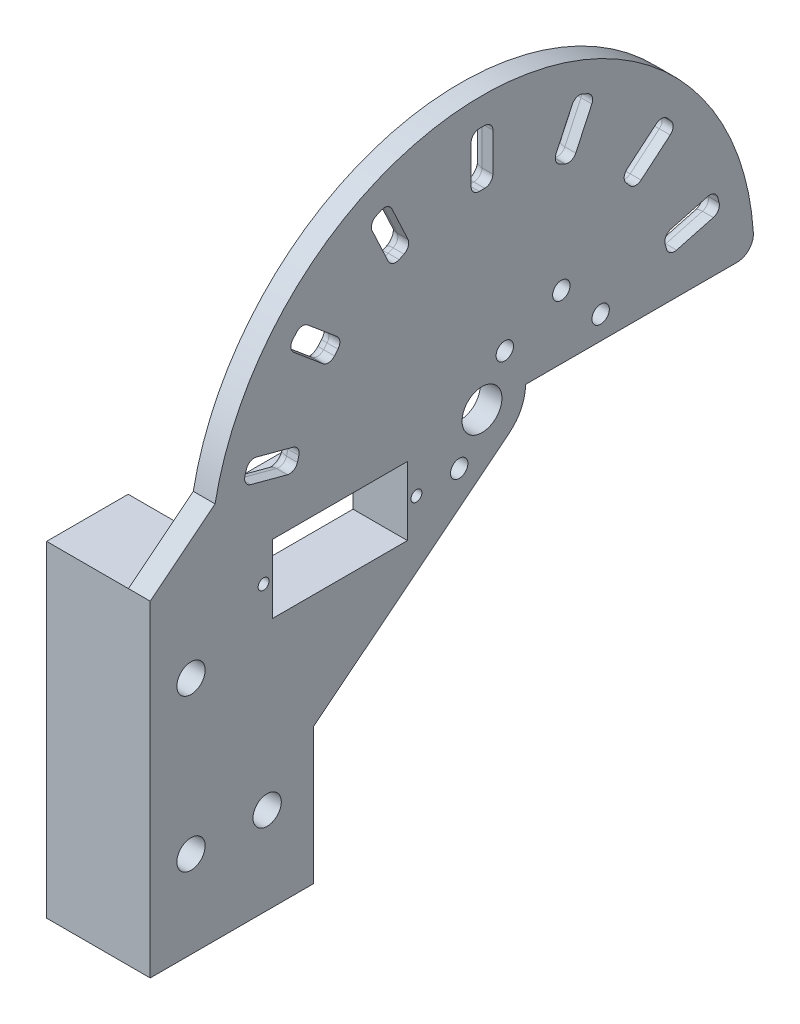
from build123d import *

# Parameters (mm, degrees)
BOSS_EXTRUDE1_START          = -21.95
BOSS_EXTRUDE1_DEPTH          = 10
BOSS_EXTRUDE2_START          = -11.95
SKETCH1_3_R                  = 1.6
SKETCH1_3_R_2                = 3.6655
BOSS_EXTRUDE2_DEPTH          = 4
BOSS_EXTRUDE3_START          = -11.95
SKETCH1_5_R                  = 1.6
SKETCH1_5_R_2                = 3.6655
BOSS_EXTRUDE3_DEPTH          = 4
BOSS_EXTRUDE4_DEPTH          = 15.05
SKETCH3_R                    = 2.6
CUT_EXTRUDE1_DEPTH           = 3.9
CUT_EXTRUDE1_DRAFT           = -1.5
CUT_EXTRUDE1_PROFILE_2_DEPTH = 3.9
CUT_EXTRUDE1_PROFILE_2_DRAFT = -1.5
SKETCH3_3_R                  = 1.6
CUT_EXTRUDE2_DEPTH           = 10
SKETCH4_R                    = 1.6
CUT_EXTRUDE3_DEPTH           = 94.316142762
SKETCH4_3_R                  = 2.6
CUT_EXTRUDE4_DEPTH           = 3.9
CUT_EXTRUDE4_DRAFT           = -1.5
CUT_EXTRUDE4_PROFILE_2_DEPTH = 3.9
CUT_EXTRUDE4_PROFILE_2_DRAFT = -1.5
CUT_EXTRUDE4_PROFILE_3_DEPTH = 3.9
CUT_EXTRUDE4_PROFILE_3_DRAFT = -1.5
BOSS_EXTRUDE5_DEPTH          = 4
SKETCH6_R                    = 1.6
CUT_EXTRUDE5_DEPTH           = 99.607821698
SKETCH7_R                    = 1.6
CUT_EXTRUDE6_DEPTH           = 99.607821698
SKETCH8_R                    = 1
CUT_EXTRUDE7_DEPTH           = 98.964279204
BOSS_EXTRUDE6_DEPTH          = 4
CUT_EXTRUDE8_DEPTH           = 127.678737363
FILLET1_R                    = 2


with BuildPart() as part:
    # Sketch1 → Boss-Extrude1 (new body)
    with BuildSketch(Plane(origin=(0, 0, 0), x_dir=(0, 0, -1), z_dir=(1, 0, 0)).offset(BOSS_EXTRUDE1_START)):
        Polygon((-8.460952046, 43.003061543), (-7.709637027, 43.603174314), (-7.709637027, 61.603061543), (-44.509637027, 61.603061543), (-44.509637027, 43.003061543), align=None)
        Polygon((-38.509637027, 46.003061543), (-38.509637027, 58.603061543), (-36.609637027, 58.603061543), (-15.609637027, 58.603061543), (-13.709637027, 58.603061543), (-13.709637027, 55.244664886), (-13.709637027, 46.003061543), (-15.609637027, 46.003061543), (-36.609637027, 46.003061543), align=None, mode=Mode.SUBTRACT)
    extrude(amount=BOSS_EXTRUDE1_DEPTH)

    # Sketch1<3> → Boss-Extrude2 (add)
    with BuildSketch(Plane(origin=(0, 0, 0), x_dir=(0, 0, -1), z_dir=(1, 0, 0)).offset(BOSS_EXTRUDE2_START)):
        with BuildLine():
            Line((-7.709637027, 61.603061543), (-7.709637027, 43.603174314))
            Line((-7.709637027, 43.603174314), (4.992794118, 53.749239495))
            ThreePointArc((4.992794118, 53.749239495), (7.359885637, 63.135615316), (-1.049180328, 67.930902889))
            Line((-1.049180328, 67.930902889), (-61, 60))
            Line((-61, 60), (-61, 0))
            Line((-61, 0), (-31, 0))
            Line((-31, 0), (-31, 25))
            Line((-31, 25), (-8.460952046, 43.003061543))
            Line((-8.460952046, 43.003061543), (-44.509637027, 43.003061543))
            Line((-44.509637027, 43.003061543), (-44.509637027, 61.603061543))
            Line((-44.509637027, 61.603061543), (-7.709637027, 61.603061543))
        make_face()
        with Locations(Location((-4.191, 52.740975065, 0), (0, 0, 90))):
            Circle(SKETCH1_3_R, mode=Mode.SUBTRACT)
        with Locations(Location((0, 60, 0), (0, 0, 90))):
            Circle(SKETCH1_3_R_2, mode=Mode.SUBTRACT)
    extrude(amount=-BOSS_EXTRUDE2_DEPTH)

    # Sketch1<5> → Boss-Extrude3 (add)
    with BuildSketch(Plane(origin=(0, 0, 0), x_dir=(0, 0, -1), z_dir=(1, 0, 0)).offset(BOSS_EXTRUDE3_START)):
        with BuildLine():
            Line((-7.709637027, 61.603061543), (-7.709637027, 43.603174314))
            Line((-7.709637027, 43.603174314), (4.992794118, 53.749239495))
            ThreePointArc((4.992794118, 53.749239495), (7.359885637, 63.135615316), (-1.049180328, 67.930902889))
            Line((-1.049180328, 67.930902889), (-61, 60))
            Line((-61, 60), (-61, 0))
            Line((-61, 0), (-31, 0))
            Line((-31, 0), (-31, 25))
            Line((-31, 25), (-8.460952046, 43.003061543))
            Line((-8.460952046, 43.003061543), (-44.509637027, 43.003061543))
            Line((-44.509637027, 43.003061543), (-44.509637027, 61.603061543))
            Line((-44.509637027, 61.603061543), (-7.709637027, 61.603061543))
        make_face()
        with Locations(Location((-4.191, 52.740975065, 0), (0, 0, 90))):
            Circle(SKETCH1_5_R, mode=Mode.SUBTRACT)
        with Locations(Location((0, 60, 0), (0, 0, 90))):
            Circle(SKETCH1_5_R_2, mode=Mode.SUBTRACT)
    extrude(amount=-BOSS_EXTRUDE3_DEPTH)

    # Sketch2 → Boss-Extrude4 (add)
    with BuildSketch(Plane.ZY.offset(15.95)):
        Polygon((31, 25), (31, 30), (46, 30), (46, 60), (61, 60), (61, 0), (31, 0), align=None)
    extrude(amount=BOSS_EXTRUDE4_DEPTH)


with BuildPart() as cut_extrude1_tool:
    # Sketch3 → Cut-Extrude1 (with draft: the straight prism first)
    with BuildSketch(Plane.XZ):
        with Locations((-21.475, 53.5)):
            Circle(SKETCH3_R)
    extrude(amount=-CUT_EXTRUDE1_DEPTH)
    # Cut-Extrude1: the draft: its side faces are tilted about the plane it starts from
    cut_extrude1_sides = [cut_extrude1_tool.faces().sort_by_distance(p)[0] for p in [
        (-24.075, 1.95, 53.5),
    ]]
    draft(cut_extrude1_sides, Plane.XZ, CUT_EXTRUDE1_DRAFT)


with BuildPart() as part_1:
    add(part.part)

    # Cut-Extrude1: cut by cut_extrude1_tool
    add(cut_extrude1_tool.part, mode=Mode.SUBTRACT)


with BuildPart() as cut_extrude1_profile_2_tool:
    # Sketch3 → Cut-Extrude1 profile 2 (with draft: the straight prism first)
    with BuildSketch(Plane.XZ):
        with Locations((-21.475, 38.5)):
            Circle(SKETCH3_R)
    extrude(amount=-CUT_EXTRUDE1_PROFILE_2_DEPTH)
    # Cut-Extrude1 profile 2: the draft: its side faces are tilted about the plane it starts from
    cut_extrude1_profile_2_sides = [cut_extrude1_profile_2_tool.faces().sort_by_distance(p)[0] for p in [
        (-24.075, 1.95, 38.5),
    ]]
    draft(cut_extrude1_profile_2_sides, Plane.XZ, CUT_EXTRUDE1_PROFILE_2_DRAFT)


with BuildPart() as part_2:
    add(part_1.part)

    # Cut-Extrude1 profile 2: cut by cut_extrude1_profile_2_tool
    add(cut_extrude1_profile_2_tool.part, mode=Mode.SUBTRACT)

    # Sketch3<3> → Cut-Extrude2 (cut)
    with BuildSketch(Plane.XZ):
        with Locations(Location((-21.475, 53.5, 0), (0, 0, 270))):
            Circle(SKETCH3_3_R)
        with Locations(Location((-21.475, 38.5, 0), (0, 0, 270))):
            Circle(SKETCH3_3_R)
    extrude(amount=-CUT_EXTRUDE2_DEPTH, mode=Mode.SUBTRACT)

    # Sketch4 → Cut-Extrude3 (cut, through all)
    with BuildSketch(Plane(origin=(-11.95, 0, 0), x_dir=(0, 0, -1), z_dir=(1, 0, 0))):
        with Locations(Location((-53.5, 44, 0), (0, 0, 90))):
            Circle(SKETCH4_R)
        with Locations(Location((-53.5, 16, 0), (0, 0, 90))):
            Circle(SKETCH4_R)
        with Locations(Location((-39.5, 16, 0), (0, 0, 90))):
            Circle(SKETCH4_R)
    extrude(amount=-CUT_EXTRUDE3_DEPTH, mode=Mode.SUBTRACT)


with BuildPart() as cut_extrude4_tool:
    # Sketch4<3> → Cut-Extrude4 (with draft: the straight prism first)
    with BuildSketch(Plane(origin=(-11.95, 0, 0), x_dir=(0, 0, -1), z_dir=(1, 0, 0))):
        with Locations((-39.5, 16)):
            Circle(SKETCH4_3_R)
    extrude(amount=-CUT_EXTRUDE4_DEPTH)
    # Cut-Extrude4: the draft: its side faces are tilted about the plane it starts from
    cut_extrude4_sides = [cut_extrude4_tool.faces().sort_by_distance(p)[0] for p in [
        (-13.9, 16, 42.1),
    ]]
    draft(cut_extrude4_sides, Plane(origin=(-11.95, 0, 0), x_dir=(0, 0, -1), z_dir=(1, 0, 0)), CUT_EXTRUDE4_DRAFT)


with BuildPart() as part_3:
    add(part_2.part)

    # Cut-Extrude4: cut by cut_extrude4_tool
    add(cut_extrude4_tool.part, mode=Mode.SUBTRACT)


with BuildPart() as cut_extrude4_profile_2_tool:
    # Sketch4<3> → Cut-Extrude4 profile 2 (with draft: the straight prism first)
    with BuildSketch(Plane(origin=(-11.95, 0, 0), x_dir=(0, 0, -1), z_dir=(1, 0, 0))):
        with Locations((-53.5, 44)):
            Circle(SKETCH4_3_R)
    extrude(amount=-CUT_EXTRUDE4_PROFILE_2_DEPTH)
    # Cut-Extrude4 profile 2: the draft: its side faces are tilted about the plane it starts from
    cut_extrude4_profile_2_sides = [cut_extrude4_profile_2_tool.faces().sort_by_distance(p)[0] for p in [
        (-13.9, 44, 56.1),
    ]]
    draft(cut_extrude4_profile_2_sides, Plane(origin=(-11.95, 0, 0), x_dir=(0, 0, -1), z_dir=(1, 0, 0)), CUT_EXTRUDE4_PROFILE_2_DRAFT)


with BuildPart() as part_4:
    add(part_3.part)

    # Cut-Extrude4 profile 2: cut by cut_extrude4_profile_2_tool
    add(cut_extrude4_profile_2_tool.part, mode=Mode.SUBTRACT)


with BuildPart() as cut_extrude4_profile_3_tool:
    # Sketch4<3> → Cut-Extrude4 profile 3 (with draft: the straight prism first)
    with BuildSketch(Plane(origin=(-11.95, 0, 0), x_dir=(0, 0, -1), z_dir=(1, 0, 0))):
        with Locations((-53.5, 16)):
            Circle(SKETCH4_3_R)
    extrude(amount=-CUT_EXTRUDE4_PROFILE_3_DEPTH)
    # Cut-Extrude4 profile 3: the draft: its side faces are tilted about the plane it starts from
    cut_extrude4_profile_3_sides = [cut_extrude4_profile_3_tool.faces().sort_by_distance(p)[0] for p in [
        (-13.9, 16, 56.1),
    ]]
    draft(cut_extrude4_profile_3_sides, Plane(origin=(-11.95, 0, 0), x_dir=(0, 0, -1), z_dir=(1, 0, 0)), CUT_EXTRUDE4_PROFILE_3_DRAFT)


with BuildPart() as part_5:
    add(part_4.part)

    # Cut-Extrude4 profile 3: cut by cut_extrude4_profile_3_tool
    add(cut_extrude4_profile_3_tool.part, mode=Mode.SUBTRACT)

    # Sketch5 → Boss-Extrude5 (add)
    with BuildSketch(Plane(origin=(-11.95, 0, 0), x_dir=(0, 0, -1), z_dir=(1, 0, 0))):
        with BuildLine():
            Line((-41, 76), (-61, 60))
            Line((-61, 60), (-1.049180328, 67.930902889))
            ThreePointArc((-1.049180328, 67.930902889), (5.272881441, 66.016371108), (8, 60))
            Line((8, 60), (26, 60))
            Line((26, 60), (26, 76))
            Line((26, 76), (-41, 76))
        make_face()
    extrude(amount=-BOSS_EXTRUDE5_DEPTH)

    # Sketch6 → Cut-Extrude5 (cut, through all)
    with BuildSketch(Plane.ZY.offset(15.95)):
        with Locations(Location((-14.588600817, 71.703999162, 0), (0, 0, 270))):
            Circle(SKETCH6_R)
        with Locations(Location((-21.811399183, 64.296000838, 0), (0, 0, 270))):
            Circle(SKETCH6_R)
    extrude(amount=-CUT_EXTRUDE5_DEPTH, mode=Mode.SUBTRACT)

    # Sketch7 → Cut-Extrude6 (cut, through all)
    with BuildSketch(Plane.ZY.offset(15.95)):
        with Locations(Location((-4.191, 67.259024935, 0), (0, 0, 90))):
            Circle(SKETCH7_R)
    extrude(amount=-CUT_EXTRUDE6_DEPTH, mode=Mode.SUBTRACT)

    # Sketch8 → Cut-Extrude7 (cut, through all)
    with BuildSketch(Plane.ZY.offset(21.95)):
        with Locations(Location((12.059637027, 52.303061543, 0), (0, 0, 270))):
            Circle(SKETCH8_R)
        with Locations(Location((40.159637027, 52.303061543, 0), (0, 0, 270))):
            Circle(SKETCH8_R)
    extrude(amount=-CUT_EXTRUDE7_DEPTH, mode=Mode.SUBTRACT)

    # Sketch10 → Boss-Extrude6 (add)
    with BuildSketch(Plane.ZY.offset(15.95)):
        with BuildLine():
            Line((-26, 60), (-26, 76))
            Line((-26, 76), (41, 76))
            Line((41, 76), (49.082633128, 69.533893498))
            ThreePointArc((49.082633128, 69.533893498), (-3.197302714, 109.897667835), (-49.898039998, 63.191489362))
            ThreePointArc((-49.898039998, 63.191489362), (-49.092132471, 60.947497635), (-46.904157598, 60))
            Line((-46.904157598, 60), (-26, 60))
        make_face()
    extrude(amount=-BOSS_EXTRUDE6_DEPTH)

    # Detent Cutouts → Cut-Extrude8 (cut, through all)
    with BuildSketch(Plane.ZY.offset(15.95)):
        with BuildLine():
            Line((35.770480839, 67.514119093), (42.531961623, 69.325852408))
            ThreePointArc((42.531961623, 69.325852408), (43.442771161, 70.024741148), (43.592621794, 71.162969716))
            Line((43.592621794, 71.162969716), (43.333802749, 72.128895542))
            ThreePointArc((43.333802749, 72.128895542), (42.63491401, 73.03970508), (41.496685442, 73.189555714))
            Line((41.496685442, 73.189555714), (34.735204658, 71.377822398))
            ThreePointArc((34.735204658, 71.377822398), (33.82439512, 70.678933658), (33.674544486, 69.540705091))
            Line((33.674544486, 69.540705091), (33.933363532, 68.574779265))
            ThreePointArc((33.933363532, 68.574779265), (34.632252271, 67.663969727), (35.770480839, 67.514119093))
        make_face()
        with BuildLine():
            Line((26.672310942, 84.991540853), (32.034622044, 89.49105412))
            ThreePointArc((32.034622044, 89.49105412), (33.129537072, 89.836279503), (34.147870123, 89.30616887))
            Line((34.147870123, 89.30616887), (34.790657733, 88.540124427))
            ThreePointArc((34.790657733, 88.540124427), (35.135883115, 87.445209399), (34.605772482, 86.426876348))
            Line((34.605772482, 86.426876348), (29.243461381, 81.92736308))
            ThreePointArc((29.243461381, 81.92736308), (28.148546352, 81.582137698), (27.130213301, 82.11224833))
            Line((27.130213301, 82.11224833), (26.487425692, 82.878292773))
            ThreePointArc((26.487425692, 82.878292773), (26.142200309, 83.973207802), (26.672310942, 84.991540853))
        make_face()
        with BuildLine():
            Line((13.611441552, 93.922233772), (16.569769384, 100.266388281))
            ThreePointArc((16.569769384, 100.266388281), (17.416200849, 101.041999819), (18.563158457, 100.991922569))
            Line((18.563158457, 100.991922569), (19.469466244, 100.569304307))
            ThreePointArc((19.469466244, 100.569304307), (20.245077782, 99.722872842), (20.195000532, 98.575915234))
            Line((20.195000532, 98.575915234), (17.2366727, 92.231760725))
            ThreePointArc((17.2366727, 92.231760725), (16.390241234, 91.456149186), (15.243283626, 91.506226437))
            Line((15.243283626, 91.506226437), (14.336975839, 91.928844698))
            ThreePointArc((14.336975839, 91.928844698), (13.561364301, 92.775276164), (13.611441552, 93.922233772))
        make_face()
        with BuildLine():
            Line((-2, 96.496428389), (-2, 103.496428389))
            ThreePointArc((-2, 103.496428389), (-1.560660172, 104.557088561), (-0.5, 104.996428389))
            Line((-0.5, 104.996428389), (0.5, 104.996428389))
            ThreePointArc((0.5, 104.996428389), (1.560660172, 104.557088561), (2, 103.496428389))
            Line((2, 103.496428389), (2, 96.496428389))
            ThreePointArc((2, 96.496428389), (1.560660172, 95.435768217), (0.5, 94.996428389))
            Line((0.5, 94.996428389), (-0.5, 94.996428389))
            ThreePointArc((-0.5, 94.996428389), (-1.560660172, 95.435768217), (-2, 96.496428389))
        make_face()
        with BuildLine():
            Line((-17.2366727, 92.231760725), (-20.195000532, 98.575915234))
            ThreePointArc((-20.195000532, 98.575915234), (-20.245077782, 99.722872842), (-19.469466244, 100.569304307))
            Line((-19.469466244, 100.569304307), (-18.563158457, 100.991922569))
            ThreePointArc((-18.563158457, 100.991922569), (-17.416200849, 101.041999819), (-16.569769384, 100.266388281))
            Line((-16.569769384, 100.266388281), (-13.611441552, 93.922233772))
            ThreePointArc((-13.611441552, 93.922233772), (-13.561364301, 92.775276164), (-14.336975839, 91.928844698))
            Line((-14.336975839, 91.928844698), (-15.243283626, 91.506226437))
            ThreePointArc((-15.243283626, 91.506226437), (-16.390241234, 91.456149186), (-17.2366727, 92.231760725))
        make_face()
        with BuildLine():
            Line((-29.243461381, 81.92736308), (-34.605772482, 86.426876348))
            ThreePointArc((-34.605772482, 86.426876348), (-35.135883115, 87.445209399), (-34.790657733, 88.540124427))
            Line((-34.790657733, 88.540124427), (-34.147870123, 89.30616887))
            ThreePointArc((-34.147870123, 89.30616887), (-33.129537072, 89.836279503), (-32.034622044, 89.49105412))
            Line((-32.034622044, 89.49105412), (-26.672310942, 84.991540853))
            ThreePointArc((-26.672310942, 84.991540853), (-26.142200309, 83.973207802), (-26.487425692, 82.878292773))
            Line((-26.487425692, 82.878292773), (-27.130213301, 82.11224833))
            ThreePointArc((-27.130213301, 82.11224833), (-28.148546352, 81.582137698), (-29.243461381, 81.92736308))
        make_face()
        with BuildLine():
            Line((-35.770480839, 67.514119093), (-42.531961623, 69.325852408))
            ThreePointArc((-42.531961623, 69.325852408), (-43.442771161, 70.024741148), (-43.592621794, 71.162969716))
            Line((-43.592621794, 71.162969716), (-43.333802749, 72.128895542))
            ThreePointArc((-43.333802749, 72.128895542), (-42.63491401, 73.03970508), (-41.496685442, 73.189555714))
            Line((-41.496685442, 73.189555714), (-34.735204658, 71.377822398))
            ThreePointArc((-34.735204658, 71.377822398), (-33.82439512, 70.678933658), (-33.674544486, 69.540705091))
            Line((-33.674544486, 69.540705091), (-33.933363532, 68.574779265))
            ThreePointArc((-33.933363532, 68.574779265), (-34.632252271, 67.663969727), (-35.770480839, 67.514119093))
        make_face()
    extrude(amount=-CUT_EXTRUDE8_DEPTH, mode=Mode.SUBTRACT)

    # Fillet1
    fillet1_edges = [part_5.edges().sort_by_distance(p)[0] for p in [
        (-15.95, 70.024741148, -43.442771161),
        (-15.95, 68.419985751, -39.151221231),
        (-15.95, 67.663969727, -34.632252271),
        (-15.95, 69.057742178, -33.803954009),
        (-15.95, 70.678933658, -33.82439512),
        (-15.95, 72.283689056, -38.11594505),
        (-15.95, 73.03970508, -42.63491401),
        (-15.95, 71.645932629, -43.463212272),
        (-15.95, 87.445209399, -35.135883115),
        (-15.95, 84.177119714, -31.924616932),
        (-15.95, 81.582137698, -28.148546352),
        (-15.95, 82.495270552, -26.808819497),
        (-15.95, 83.973207802, -26.142200309),
        (-15.95, 87.241297487, -29.353466493),
        (-15.95, 89.836279503, -33.129537072),
        (-15.95, 88.923146649, -34.469263928),
        (-15.95, 99.722872842, -20.245077782),
        (-15.95, 95.403837979, -18.715836616),
        (-15.95, 91.456149186, -16.390241234),
        (-15.95, 91.717535568, -14.790129733),
        (-15.95, 92.775276164, -13.561364301),
        (-15.95, 97.094311026, -15.090605468),
        (-15.95, 101.041999819, -17.416200849),
        (-15.95, 100.780613438, -19.01631235),
        (-15.95, 104.557088561, -1.560660172),
        (-15.95, 99.996428389, -2),
        (-15.95, 95.435768217, -1.560660172),
        (-15.95, 94.996428389, 0),
        (-15.95, 95.435768217, 1.560660172),
        (-15.95, 99.996428389, 2),
        (-15.95, 104.557088561, 1.560660172),
        (-15.95, 104.996428389, 0),
        (-15.95, 101.041999819, 17.416200849),
        (-15.95, 97.094311026, 15.090605468),
        (-15.95, 92.775276164, 13.561364301),
        (-15.95, 91.717535568, 14.790129733),
        (-15.95, 91.456149186, 16.390241234),
        (-15.95, 95.403837979, 18.715836616),
        (-15.95, 99.722872842, 20.245077782),
        (-15.95, 100.780613438, 19.01631235),
        (-15.95, 89.836279503, 33.129537072),
        (-15.95, 87.241297487, 29.353466493),
        (-15.95, 83.973207802, 26.142200309),
        (-15.95, 82.495270552, 26.808819497),
        (-15.95, 81.582137698, 28.148546352),
        (-15.95, 84.177119714, 31.924616932),
        (-15.95, 87.445209399, 35.135883115),
        (-15.95, 88.923146649, 34.469263928),
        (-15.95, 73.03970508, 42.63491401),
        (-15.95, 72.283689056, 38.11594505),
        (-15.95, 70.678933658, 33.82439512),
        (-15.95, 69.057742178, 33.803954009),
        (-15.95, 67.663969727, 34.632252271),
        (-15.95, 68.419985751, 39.151221231),
        (-15.95, 70.024741148, 43.442771161),
        (-15.95, 71.645932629, 43.463212272),
    ]]
    fillet(fillet1_edges, radius=FILLET1_R)


solid = part_5.part
